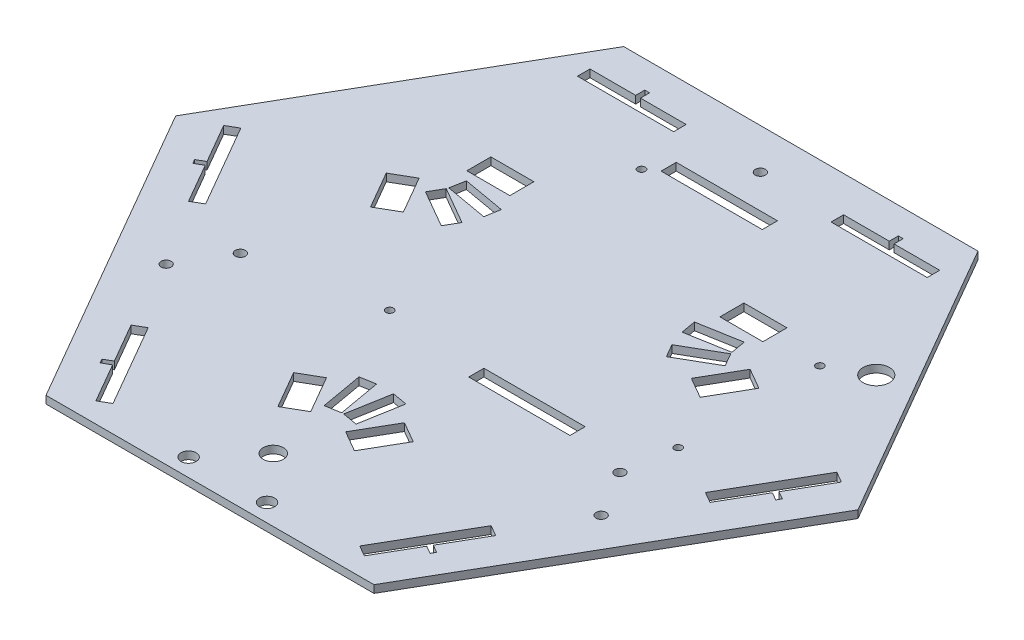
from build123d import *

# Parameters (mm, degrees)
SKETCH1_R           = 5.08
SKETCH1_R_2         = 3.81
SKETCH1_R_3         = 2.54
SKETCH1_R_4         = 1.905
SKETCH1_R_5         = 6.604
SKETCH1_W           = 21.59
SKETCH1_H           = 12.065
SKETCH1_W_2         = 50.8
SKETCH1_H_2         = 7.62
BOSS_EXTRUDE1_DEPTH = 3.81


with BuildPart() as part:
    # Sketch1 → Boss-Extrude1 (new body)
    with BuildSketch(Plane(origin=(0, 0, 0), x_dir=(1, 0, 0), z_dir=(0, 1, 0))):
        Polygon((82.300886423, -148.264316793), (171.200886423, 5.715), (88.9, 148.264316793), (-88.9, 148.264316793), (-171.200886423, 5.715), (-82.300886423, -148.264316793), align=None)
        with Locations(Location((0, -116.514316793, 0), (0, 0, 90))):
            Circle(SKETCH1_R, mode=Mode.SUBTRACT)
        with Locations(Location((-19.658728346, -139.347010207, 0), (0, 0, 90))):
            Circle(SKETCH1_R_2, mode=Mode.SUBTRACT)
        with Locations(Location((19.711271654, -139.347010207, 0), (0, 0, 90))):
            Circle(SKETCH1_R_2, mode=Mode.SUBTRACT)
        with Locations(Location((-95.25, -37.774316793, 0), (0, 0, 90))):
            Circle(SKETCH1_R_3, mode=Mode.SUBTRACT)
        with Locations(Location((95.25, -37.774316793, 0), (0, 0, 90))):
            Circle(SKETCH1_R_3, mode=Mode.SUBTRACT)
        with Locations(Location((-31.113749598, 99.396218431, 0), (0, 0, 90))):
            Circle(SKETCH1_R_4, mode=Mode.SUBTRACT)
        with Locations(Location((-33.02, -25.074316793, 0), (0, 0, 90))):
            Circle(SKETCH1_R_4, mode=Mode.SUBTRACT)
        with Locations(Location((99.06, -12.374316793, 0), (0, 0, 90))):
            Circle(SKETCH1_R_4, mode=Mode.SUBTRACT)
        with Locations(Location((99.06, 58.745683207, 0), (0, 0, 90))):
            Circle(SKETCH1_R_4, mode=Mode.SUBTRACT)
        with Locations(Location((0, 127.944316793, 0), (0, 0, 90))):
            Circle(SKETCH1_R_3, mode=Mode.SUBTRACT)
        with Locations(Location((-109.153250218, -61.114658396, 0), (0, 0, 90))):
            Circle(SKETCH1_R_3, mode=Mode.SUBTRACT)
        with Locations(Location((109.153250218, -61.114658396, 0), (0, 0, 90))):
            Circle(SKETCH1_R_3, mode=Mode.SUBTRACT)
        with Locations(Location((117.245502559, 68.866615534, 0), (0, 0, 90))):
            Circle(SKETCH1_R_5, mode=Mode.SUBTRACT)
        Polygon((-39.37, 123.785885114), (-39.37, 130.072385114), (-62.2935, 130.072385114), (-62.2935, 134.644385114), (-64.7065, 134.644385114), (-64.7065, 130.072385114), (-87.63, 130.072385114), (-87.63, 123.785885114), align=None, mode=Mode.SUBTRACT)
        Polygon((39.37, 124.039885114), (39.37, 130.326385114), (62.2935, 130.326385114), (62.2935, 134.898385114), (64.7065, 134.898385114), (64.7065, 130.326385114), (87.63, 130.326385114), (87.63, 124.039885114), align=None, mode=Mode.SUBTRACT)
        Polygon((125.416983138, -25.040114979), (130.861251839, -28.183364979), (142.323001839, -8.331031636), (146.282469985, -10.617031636), (147.488969985, -8.527312336), (143.529501839, -6.241312336), (154.991251839, 13.611021007), (149.546983138, 16.754271007), align=None, mode=Mode.SUBTRACT)
        Polygon((86.046983138, -93.230955273), (91.491251839, -96.374205273), (80.029501839, -116.226538617), (83.988969985, -118.512538617), (82.782469985, -120.602257916), (78.823001839, -118.316257916), (67.361251839, -138.16859126), (61.916983138, -135.02534126), align=None, mode=Mode.SUBTRACT)
        Polygon((-61.916983138, -135.02534126), (-67.361251839, -138.16859126), (-78.823001839, -118.316257916), (-82.782469985, -120.602257916), (-83.988969985, -118.512538617), (-80.029501839, -116.226538617), (-91.491251839, -96.374205273), (-86.046983138, -93.230955273), align=None, mode=Mode.SUBTRACT)
        Polygon((-125.416983138, -25.040114979), (-130.861251839, -28.183364979), (-142.323001839, -8.331031636), (-146.282469985, -10.617031636), (-147.488969985, -8.527312336), (-143.529501839, -6.241312336), (-154.991251839, 13.611021007), (-149.546983138, 16.754271007), align=None, mode=Mode.SUBTRACT)
        with Locations((63.5, 60.951816793)):
            Rectangle(SKETCH1_W, SKETCH1_H, mode=Mode.SUBTRACT)
        Polygon((83.059245107, 39.739198978), (72.264245107, 21.04171051), (82.712841604, 15.00921051), (93.507841604, 33.706698978), align=None, mode=Mode.SUBTRACT)
        with Locations((-63.5, 60.951816793)):
            Rectangle(SKETCH1_W, SKETCH1_H, mode=Mode.SUBTRACT)
        Polygon((-72.264245107, 21.04171051), (-83.059245107, 39.739198978), (-93.507841604, 33.706698978), (-82.712841604, 15.00921051), align=None, mode=Mode.SUBTRACT)
        Polygon((-19.559245107, -70.246027303), (-30.007841604, -76.278527303), (-19.212841604, -94.976015771), (-8.764245107, -88.943515771), align=None, mode=Mode.SUBTRACT)
        Polygon((19.559245107, -70.246027303), (8.764245107, -88.943515771), (19.212841604, -94.976015771), (30.007841604, -76.278527303), align=None, mode=Mode.SUBTRACT)
        Polygon((-0.508, -81.661), (-4.257064156, -60.399000612), (-11.761299234, -61.722199726), (-8.012235078, -82.984199114), align=None, mode=Mode.SUBTRACT)
        Polygon((4.257064156, -60.399000612), (0.508, -81.661), (8.012235078, -82.984199114), (11.761299234, -61.722199726), align=None, mode=Mode.SUBTRACT)
        Polygon((71.467492466, 41.590272297), (52.770003998, 30.795272297), (56.580003998, 24.19615872), (75.277492466, 34.99115872), align=None, mode=Mode.SUBTRACT)
        Polygon((49.858000612, 38.795935844), (71.12, 42.545), (69.796800886, 50.049235078), (48.534801499, 46.300170922), align=None, mode=Mode.SUBTRACT)
        Polygon((-71.356016539, 42.952508085), (-50.094017152, 39.203443929), (-48.770818038, 46.707679007), (-70.032817426, 50.456743163), align=None, mode=Mode.SUBTRACT)
        Polygon((-53.006020537, 31.202780382), (-71.703509005, 41.997780382), (-75.513509005, 35.398666806), (-56.816020537, 24.603666806), align=None, mode=Mode.SUBTRACT)
        with Locations((0, 107.315)):
            Rectangle(SKETCH1_W_2, SKETCH1_H_2, mode=Mode.SUBTRACT)
        with Locations((41.224971045, -30.426673737)):
            Rectangle(SKETCH1_W_2, SKETCH1_H_2, mode=Mode.SUBTRACT)
    extrude(amount=BOSS_EXTRUDE1_DEPTH)


solid = part.part
